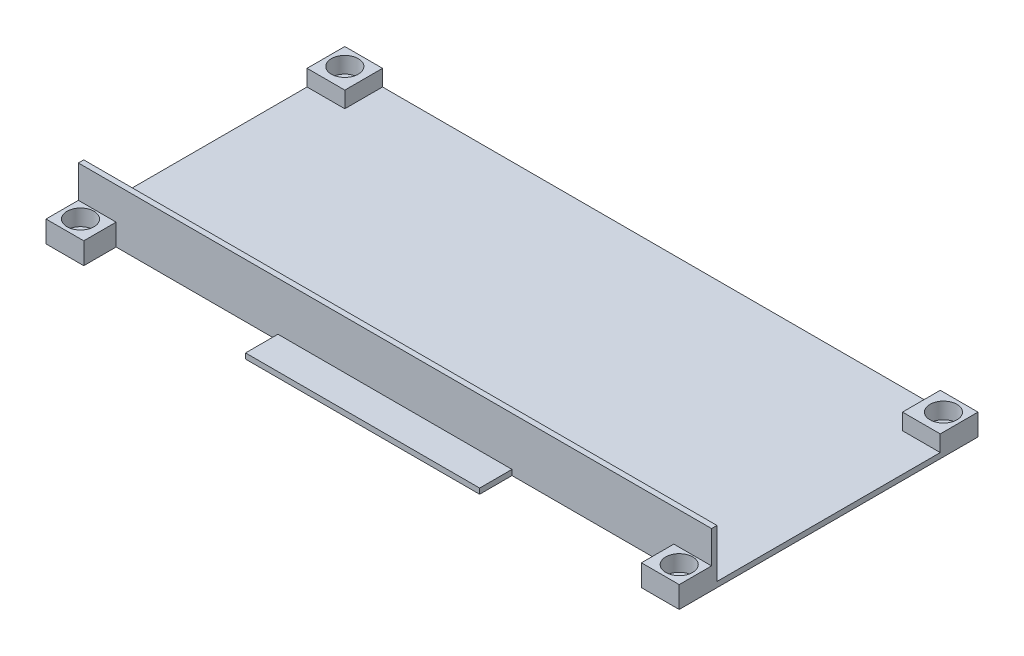
from build123d import *

# Parameters (mm, degrees)
SKETCH1_W           = 117.4
SKETCH1_H           = 55.4
BOSS_EXTRUDE1_DEPTH = 1
SKETCH2_W           = 7
SKETCH2_H           = 7
BOSS_EXTRUDE2_DEPTH = 3
SKETCH3_R           = 1.35
CUT_EXTRUDE1_DEPTH  = 66.030608178
SKETCH7_W           = 30
SKETCH7_H           = 6
CUT_EXTRUDE5_DEPTH  = 66.030608178
SKETCH9_R           = 2.5
CUT_EXTRUDE6_DEPTH  = 3
SKETCH10_W          = 117.4
SKETCH10_H          = 1
BOSS_EXTRUDE3_DEPTH = 9


with BuildPart() as part:
    # Sketch1 → Boss-Extrude1 (new body)
    with BuildSketch(Plane(origin=(0, 0, 0), x_dir=(1, 0, 0), z_dir=(0, 1, 0))):
        Rectangle(SKETCH1_W, SKETCH1_H)
    extrude(amount=BOSS_EXTRUDE1_DEPTH)

    # Sketch2 → Boss-Extrude2 (add)
    with BuildSketch(Plane(origin=(0, 1, 0), x_dir=(1, 0, 0), z_dir=(0, 1, 0))):
        with Locations((55.2, 24.2)):
            Rectangle(SKETCH2_W, SKETCH2_H)
        with Locations((-55.2, 24.2)):
            Rectangle(SKETCH2_W, SKETCH2_H)
        with Locations((55.2, -24.2)):
            Rectangle(SKETCH2_W, SKETCH2_H)
        with Locations((-55.2, -24.2)):
            Rectangle(SKETCH2_W, SKETCH2_H)
    extrude(amount=BOSS_EXTRUDE2_DEPTH)

    # Sketch3 → Cut-Extrude1 (cut, through all)
    with BuildSketch(Plane(origin=(0, 4, 0), x_dir=(1, 0, 0), z_dir=(0, 1, 0))):
        with Locations(Location((-55.5, 24.5, 0), (0, 0, 270))):
            Circle(SKETCH3_R)
        with Locations(Location((55.5, 24.5, 0), (0, 0, 270))):
            Circle(SKETCH3_R)
        with Locations(Location((55.5, -24.5, 0), (0, 0, 270))):
            Circle(SKETCH3_R)
        with Locations(Location((-55.5, -24.5, 0), (0, 0, 270))):
            Circle(SKETCH3_R)
    extrude(amount=-CUT_EXTRUDE1_DEPTH, mode=Mode.SUBTRACT)

    # Sketch7 → Cut-Extrude5 (cut, through all)
    with BuildSketch(Plane.XZ):
        with Locations((36.7, 24.7)):
            Rectangle(SKETCH7_W, SKETCH7_H)
        with Locations((-36.7, 24.7)):
            Rectangle(SKETCH7_W, SKETCH7_H)
    extrude(amount=-CUT_EXTRUDE5_DEPTH, mode=Mode.SUBTRACT)

    # Sketch9 → Cut-Extrude6 (cut)
    with BuildSketch(Plane(origin=(0, 4, 0), x_dir=(1, 0, 0), z_dir=(0, 1, 0))):
        with Locations(Location((-55.5, 24.5, 0), (0, 0, 270))):
            Circle(SKETCH9_R)
        with Locations(Location((55.5, 24.5, 0), (0, 0, 270))):
            Circle(SKETCH9_R)
        with Locations(Location((55.5, -24.5, 0), (0, 0, 270))):
            Circle(SKETCH9_R)
        with Locations(Location((-55.5, -24.5, 0), (0, 0, 270))):
            Circle(SKETCH9_R)
    extrude(amount=-CUT_EXTRUDE6_DEPTH, mode=Mode.SUBTRACT)

    # Sketch10 → Boss-Extrude3 (add)
    with BuildSketch(Plane(origin=(0, 1, 0), x_dir=(1, 0, 0), z_dir=(0, 1, 0))):
        with Locations((0, -21.2)):
            Rectangle(SKETCH10_W, SKETCH10_H)
    extrude(amount=BOSS_EXTRUDE3_DEPTH)


solid = part.part
